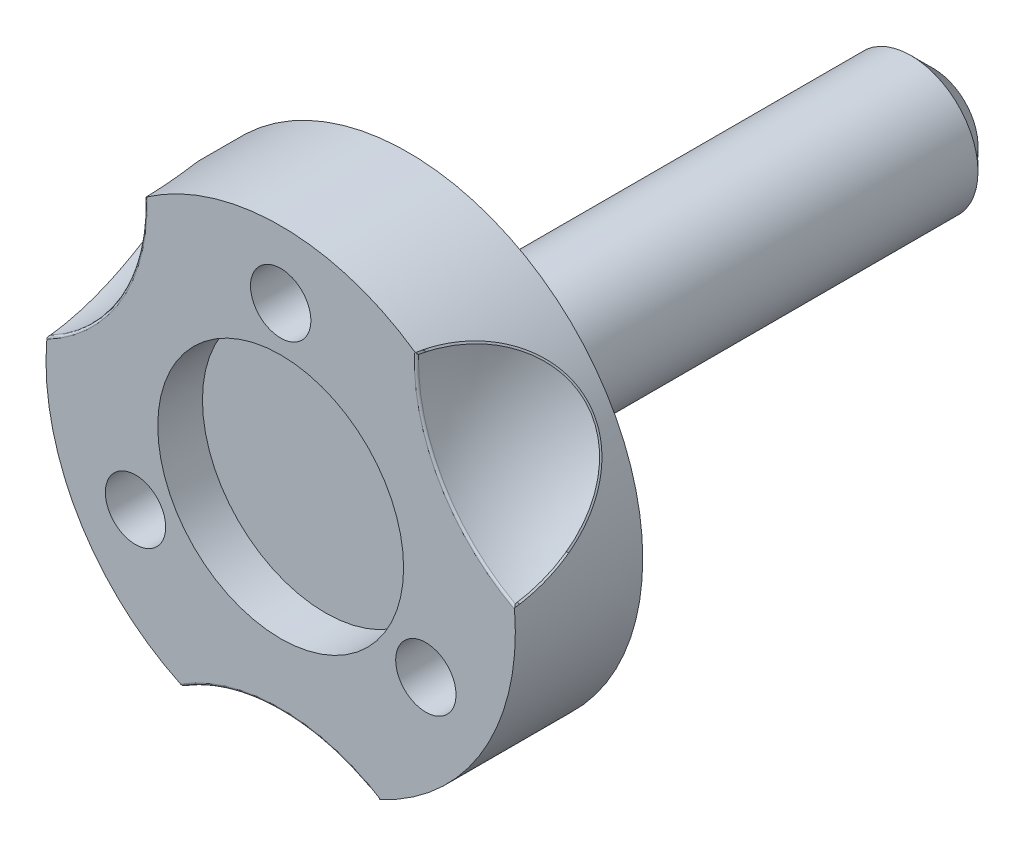
from build123d import *

# Parameters (mm, degrees)
IZIM1_R                     = 10.500000000000002
IZIM1_R_2                   = 1.35
IZIM1_R_3                   = 1.3500000000006673
IZIM1_R_4                   = 1.3500000000009666
Y_KSEKLIK_EKSTR_ZYON1_DEPTH = 6.5
IZIM1_3_R                   = 2.4
IZIM1_3_R_2                 = 2.4000000000006683
IZIM1_3_R_3                 = 2.400000000000967
KES_EKSTR_ZYON1_DEPTH       = 2.8
KES_EKSTR_ZYON2_START       = 6.5
IZIM1_4_R                   = 5.5
KES_EKSTR_ZYON2_DEPTH       = 2.8
IZIM2_R                     = 3
Y_KSEKLIK_EKSTR_ZYON2_DEPTH = 23.5
RADYUS1_R                   = 0.4
PAH1_SIZE                   = 1
KES_EKSTR_ZYON3_START       = -0.8
IZIM4_R                     = 1.3500000000009666
IZIM4_R_2                   = 1.3500000000006673
IZIM4_R_3                   = 5.5
IZIM4_R_4                   = 1.35
KES_EKSTR_ZYON3_DEPTH       = 0.8
DAIRESEL_KAPLAMA1_COUNT     = 3
IZIM6_R                     = 19.193233660438715
KES_EKSTR_ZYON4_DEPTH       = 10
RADYUS2_R                   = 0.1


with BuildPart() as part:
    # Çizim1 → Yükseklik-Ekstrüzyon1 (new body)
    with BuildSketch(Plane.XY):
        with Locations(Location((0, 0, 0), (0, 0, 180))):
            Circle(IZIM1_R)
        with Locations(Location((0, 7.5, 0), (0, 0, 180))):
            Circle(IZIM1_R_2, mode=Mode.SUBTRACT)
        with Locations(Location((6.495190528384089, -3.749999999999534, 0), (0, 0, 180))):
            Circle(IZIM1_R_3, mode=Mode.SUBTRACT)
        with Locations(Location((-6.495190528382492, -3.750000000000463, 0), (0, 0, 180))):
            Circle(IZIM1_R_4, mode=Mode.SUBTRACT)
    extrude(amount=Y_KSEKLIK_EKSTR_ZYON1_DEPTH)

    # Çizim1<3> → Kes-Ekstrüzyon1 (cut)
    with BuildSketch(Plane.XY):
        with Locations((0, 7.5)):
            Circle(IZIM1_3_R)
        with Locations((6.495190528384089, -3.749999999999534)):
            Circle(IZIM1_3_R_2)
        with Locations((-6.495190528382492, -3.750000000000463)):
            Circle(IZIM1_3_R_3)
    extrude(amount=KES_EKSTR_ZYON1_DEPTH, mode=Mode.SUBTRACT)

    # Çizim1<4> → Kes-Ekstrüzyon2 (cut)
    with BuildSketch(Plane.XY.offset(KES_EKSTR_ZYON2_START)):
        Circle(IZIM1_4_R)
    extrude(amount=-KES_EKSTR_ZYON2_DEPTH, mode=Mode.SUBTRACT)

    # Çizim2 → Yükseklik-Ekstrüzyon2 (add)
    with BuildSketch(Plane(origin=(0, 0, 0), x_dir=(-1, 0, 0), z_dir=(0, 0, -1))):
        with Locations(Location((0, 0, 0), (0, 0, 180))):
            Circle(IZIM2_R)
    extrude(amount=Y_KSEKLIK_EKSTR_ZYON2_DEPTH)

    # Radyus1
    radyus1_edges = [part.edges().sort_by_distance(p)[0] for p in [
        (-3, -7.3e-16, 0),
    ]]
    fillet(radyus1_edges, radius=RADYUS1_R)

    # Pah1
    pah1_edges = [part.edges().sort_by_distance(p)[0] for p in [
        (-3, -7.3e-16, -23.5),
    ]]
    chamfer(pah1_edges, length=PAH1_SIZE)

    # Çizim4 → Kes-Ekstrüzyon3 (cut)
    # profile 1 of 4: a face of its own
    with BuildSketch(Plane.XY.offset(6.5).offset(KES_EKSTR_ZYON3_START)):
        with BuildLine():
            ThreePointArc((10.500000000000002, -2.57e-15), (8.851817795002795, -5.6475943306926615), (4.424700623986311, -9.522185903882322))
            ThreePointArc((4.4247006239863005, -9.522185903882367), (6.379430553672234, -11.223134450469558), (7.7169810160244925, -13.442403207697554))
            ThreePointArc((7.7169810160244925, -13.442403207697554), (7.808850804904862, -13.678535593232874), (7.893497088011374, -13.917352611813584))
            ThreePointArc((7.89349708801137, -13.917352611813588), (9.257914424347321, -13.04956016544083), (10.527774518452185, -12.048483875103429))
            Line((10.527774518452187, -12.048483875103425), (10.486804019505321, -12.025160454986842))
            ThreePointArc((10.486804019505321, -12.025160454986842), (10.30779327790509, -11.879983527744216), (10.135243570935618, -11.727183709561654))
            ThreePointArc((10.135243570935618, -11.727183709561654), (9.125132387065534, -5.19469622664333), (15.257959214376504, -2.7284942023803422))
            ThreePointArc((15.257959214376504, -2.7284942023803422), (15.47743430760711, -2.7988637217995604), (15.693652911179132, -2.878680394752278))
            Line((15.693652911179134, -2.8786803947522785), (15.734623410125945, -2.902003814868831))
            ThreePointArc((15.734623410126023, -2.9020038148686935), (15.938987857484754, -1.3959463023167689), (15.999529459261957, 0.12270730299043964))
            ThreePointArc((15.999529459261984, 0.12270730299030852), (15.750384712761765, 0.07660462520612121), (15.499953173791758, 0.03810000344917697))
            ThreePointArc((15.499953173791758, 0.03810000344917697), (12.909234821030973, 0.0868183040758943), (10.458805204313217, 0.9291898074281759))
            ThreePointArc((10.458805204313322, 0.9291898074282715), (10.489696245489904, 0.46505126314747697), (10.500000000000002, 0))
        make_face()
    # profile 2 of 4: a face of its own
    with BuildSketch(Plane.XY.offset(6.5).offset(KES_EKSTR_ZYON3_START)):
        with BuildLine():
            ThreePointArc((-6.034104580327021, 8.592996096453952), (-7.144709581221623, 4.125000000000004), (-10.458805204313206, 0.9291898074283242))
            ThreePointArc((-10.45880520431331, 0.9291898074284249), (-9.093266739736672, -5.249999999999889), (-4.424700623986307, -9.522185903882324))
            ThreePointArc((-4.424700623986295, -9.522185903882361), (3.55e-15, -8.25), (4.4247006239863005, -9.522185903882367))
            ThreePointArc((4.424700623986311, -9.522185903882322), (8.851817795002795, -5.6475943306926615), (10.500000000000002, -2.57e-15))
            ThreePointArc((10.500000000000002, 0), (10.489696245489904, 0.46505126314747697), (10.458805204313322, 0.9291898074282715))
            ThreePointArc((10.458805204313215, 0.9291898074281768), (7.144709581221679, 4.124999999999903), (6.03410458032714, 8.592996096453868))
            ThreePointArc((6.034104580327348, 8.592996096453936), (7.525e-14, 10.500000000000002), (-6.034104580327227, 8.592996096454021))
        make_face()
        with Locations(Location((-6.495190528382492, -3.750000000000463, 0), (0, 0, 180))):
            Circle(IZIM4_R, mode=Mode.SUBTRACT)
        with Locations(Location((6.495190528384089, -3.749999999999534, 0), (0, 0, 180))):
            Circle(IZIM4_R_2, mode=Mode.SUBTRACT)
        Circle(IZIM4_R_3, mode=Mode.SUBTRACT)
        with Locations(Location((0, 7.5, 0), (0, 0, 180))):
            Circle(IZIM4_R_4, mode=Mode.SUBTRACT)
    # profile 3 of 4: a face of its own
    with BuildSketch(Plane.XY.offset(6.5).offset(KES_EKSTR_ZYON3_START)):
        with BuildLine():
            Line((-15.698180372152809, -3.0930782407425124), (-15.65749644835528, -3.069258457907096))
            ThreePointArc((-15.65749644835528, -3.0692584579070976), (-15.442264170519685, -2.9868190717523166), (-15.223660792795206, -2.9137865511924703))
            ThreePointArc((-15.223660792795206, -2.9137865511924703), (-9.06130509074901, -5.305248346773306), (-9.991924900528073, -11.84953318836683))
            ThreePointArc((-9.991924900528073, -11.84953318836683), (-10.162604238612523, -12.004419434892888), (-10.33983680682114, -12.1517619018807))
            Line((-10.339836806821141, -12.1517619018807), (-10.380520730618667, -12.175581684716114))
            ThreePointArc((-10.380520730618667, -12.175581684716114), (-9.17841888886765, -13.105595244035118), (-7.89349708801137, -13.917352611813591))
            ThreePointArc((-7.893497088011372, -13.91735261181359), (-7.808850804904864, -13.67853559323288), (-7.716981016024491, -13.442403207697556))
            ThreePointArc((-7.716981016024491, -13.442403207697556), (-6.379430553672231, -11.223134450469555), (-4.424700623986295, -9.522185903882361))
            ThreePointArc((-4.424700623986307, -9.522185903882324), (-9.093266739736672, -5.249999999999889), (-10.45880520431331, 0.9291898074284249))
            ThreePointArc((-10.458805204313206, 0.9291898074283242), (-12.909234821030967, 0.08681830407607904), (-15.499953173791745, 0.03810000344939191))
            ThreePointArc((-15.499953173791745, 0.03810000344939191), (-15.750384712761733, 0.07660462520633793), (-15.999529459261936, 0.12270730299052524))
            ThreePointArc((-15.999529459261959, 0.12270730299041532), (-15.930207823658876, -1.4928089948268557), (-15.698180372152802, -3.0930782407425252))
        make_face()
    # profile 4 of 4: a face of its own
    with BuildSketch(Plane.XY.offset(6.5).offset(KES_EKSTR_ZYON3_START)):
        with BuildLine():
            ThreePointArc((-8.106032371250535, 13.794645308823178), (-7.941533907856836, 13.601930968026657), (-7.782972157767214, 13.404303204248283))
            ThreePointArc((-7.782972157767214, 13.404303204248283), (-6.52980426735874, 11.136316146393476), (-6.034104580327021, 8.592996096453954))
            ThreePointArc((-6.034104580327227, 8.592996096454021), (7.525e-14, 10.500000000000002), (6.034104580327348, 8.592996096453936))
            ThreePointArc((6.03410458032714, 8.592996096453868), (6.529804267358891, 11.136316146393376), (7.782972157767389, 13.404303204248158))
            ThreePointArc((7.782972157767389, 13.404303204248158), (7.94153390785703, 13.60193096802655), (8.10603237125075, 13.79464530882309))
            ThreePointArc((8.106032371250752, 13.79464530882309), (6.672293399311588, 14.54236916026763), (5.170405853700506, 15.141562115845833))
            Line((5.17040585370058, 15.141562115845833), (5.1706924288499145, 15.094418912893822))
            ThreePointArc((5.1706924288499145, 15.094418912893822), (5.13447089261455, 14.866802599496415), (5.088417221859546, 14.640970260754006))
            ThreePointArc((5.088417221859546, 14.640970260754006), (-0.0638272963165254, 10.499944573416558), (-5.266034313848385, 14.578027390747055))
            ThreePointArc((-5.266034313848385, 14.578027390747055), (-5.314830068994544, 14.803283156692332), (-5.353816104357948, 15.030442296632861))
            Line((-5.35381610435795, 15.030442296632861), (-5.354102679507284, 15.07758549958482))
            ThreePointArc((-5.354102679507342, 15.07758549958482), (-6.760568968617106, 14.501541546351877), (-8.106032371250603, 13.794645308823117))
        make_face()
    extrude(amount=KES_EKSTR_ZYON3_DEPTH, mode=Mode.SUBTRACT)

    # Çizim5 → Kes-Döndür1 (revolve, cut)
    with BuildSketch(Plane.XY.offset(6.5)):
        with BuildLine():
            ThreePointArc((-6.03410458032703, 8.592996096454158), (-9.093266739736583, 5.250000000000045), (-10.458805204313325, 0.9291898074282618))
            ThreePointArc((-10.458805204313325, 0.9291898074282618), (-7.144709581221606, 4.1250000000000355), (-6.03410458032703, 8.592996096454158))
        make_face()
        with BuildLine():
            ThreePointArc((-7.78297215776728, 13.40430320424823), (-13.423393758658815, 7.749999999999976), (-15.49995317379176, 0.03810000344927822))
            ThreePointArc((-15.499953173791758, 0.03810000344928177), (-12.909234821031005, 0.08681830407593338), (-10.458805204313258, 0.9291898074281342))
            ThreePointArc((-10.458805204313325, 0.929189807428263), (-9.093266739736587, 5.250000000000043), (-6.03410458032703, 8.592996096454158))
            ThreePointArc((-6.034104580326996, 8.592996096454158), (-6.529804267358794, 11.136316146393556), (-7.78297215776728, 13.40430320424823))
        make_face()
    kes_d_nd_r1 = revolve(axis=Axis((-14.359319109990274, 8.29035675353271, 6.5), (0.7239288525621957, 0.6898746381973921, 0)), mode=Mode.SUBTRACT)

    # Dairesel Kaplama1: Kes-Döndür1 ×3 about axis
    dairesel_kaplama1_axis = Axis((0, 0, 5.699999999999999), (0, 0, 1))
    for i in range(1, DAIRESEL_KAPLAMA1_COUNT):
        add(kes_d_nd_r1.rotate(dairesel_kaplama1_axis, i * 360 / DAIRESEL_KAPLAMA1_COUNT), mode=Mode.SUBTRACT)

    # Çizim6 → Kes-Ekstrüzyon4 (cut)
    with BuildSketch(Plane.XY.offset(5.699999999999999)):
        with Locations((-0.23479465161813096, -0.163879333754835)):
            Circle(IZIM6_R)
    extrude(amount=KES_EKSTR_ZYON4_DEPTH, mode=Mode.SUBTRACT)

    # Radyus2
    radyus2_edges = [part.edges().sort_by_distance(p)[0] for p in [
        (9.093266739735252, 5.250000000002343, 0.8056421975964979),
        (7.1780524635513645, 4.1442505212294405, 5.699999999999999),
        (-1.84833e-12, -10.500000000000002, 0.8056421975964927),
        (-9.09326673973798, 5.249999999997622, 0.8056421975964908),
        (-7.17805246280713, 4.1442505225184965, 5.699999999999999),
        (-7.4464645e-10, -8.288501043747676, 5.699999999999999),
    ]]
    fillet(radyus2_edges, radius=RADYUS2_R)


solid = part.part
